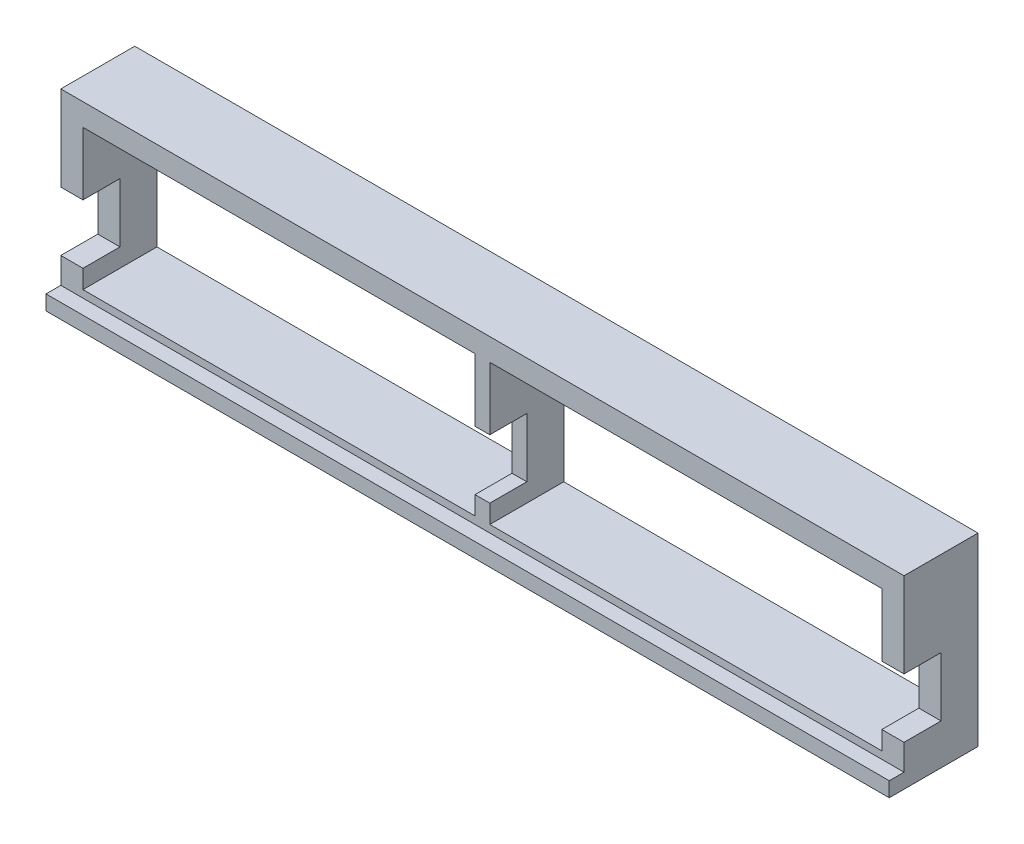
from build123d import *

# Parameters (mm, degrees)
SKETCH1_W           = 114
SKETCH1_H           = 25
SKETCH1_W_2         = 53
SKETCH1_H_2         = 19
BOSS_EXTRUDE1_DEPTH = 10
SKETCH2_W           = 114
SKETCH2_H           = 2
BOSS_EXTRUDE2_DEPTH = 2
SKETCH3_W           = 5
SKETCH3_H           = 8
CUT_EXTRUDE1_DEPTH  = 116.309366489


with BuildPart() as part:
    # Sketch1 → Boss-Extrude1 (new body)
    with BuildSketch(Plane.XY):
        Rectangle(SKETCH1_W, SKETCH1_H)
        with Locations((27.5, 0)):
            Rectangle(SKETCH1_W_2, SKETCH1_H_2, mode=Mode.SUBTRACT)
        with Locations((-27.5, 0)):
            Rectangle(SKETCH1_W_2, SKETCH1_H_2, mode=Mode.SUBTRACT)
    extrude(amount=BOSS_EXTRUDE1_DEPTH)

    # Sketch2 → Boss-Extrude2 (add)
    with BuildSketch(Plane.XY.offset(10)):
        with Locations((0, -11.5)):
            Rectangle(SKETCH2_W, SKETCH2_H)
    extrude(amount=BOSS_EXTRUDE2_DEPTH)

    # Sketch3 → Cut-Extrude1 (cut, through all)
    with BuildSketch(Plane.ZY.offset(57)):
        with Locations((7.5, -3)):
            Rectangle(SKETCH3_W, SKETCH3_H)
    extrude(amount=-CUT_EXTRUDE1_DEPTH, mode=Mode.SUBTRACT)


solid = part.part
